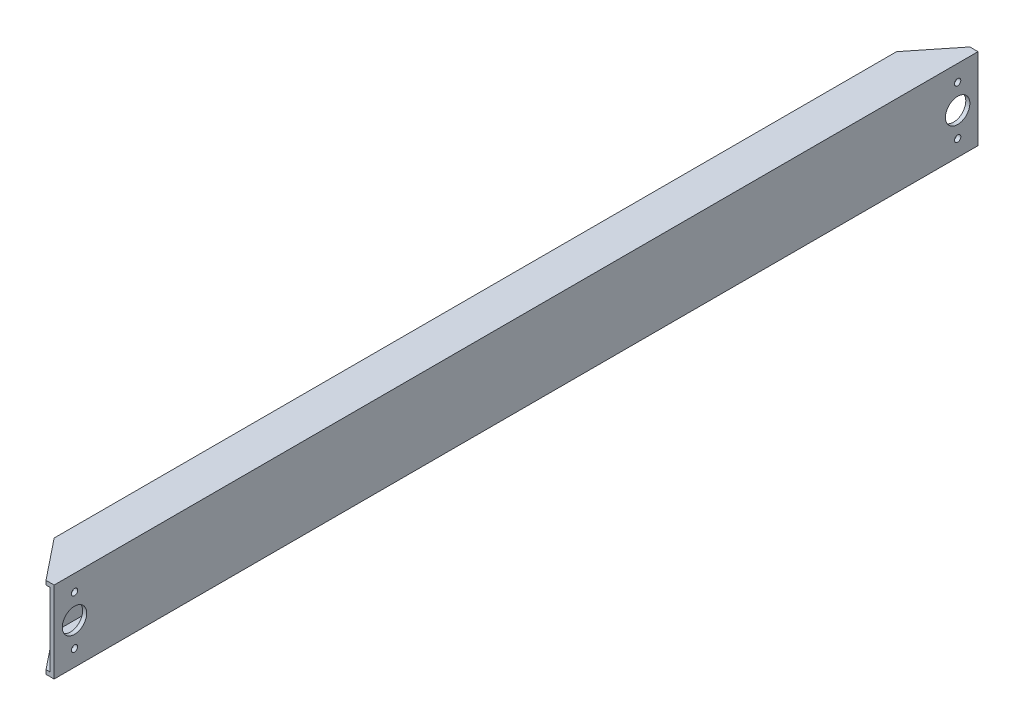
from build123d import *

# Parameters (mm, degrees)
SKETCH1_W                    = 31.75
SKETCH1_H                    = 63.5
SKETCH1_W_2                  = 25.4
SKETCH1_H_2                  = 57.15
BOSS_EXTRUDE1_DEPTH          = 720.4964
CUT_EXTRUDE1_REACH           = 725.554
F_10_0_1935_DIAMETER_HOLE1_D = 4.9149
SKETCH3_R                    = 9.525
CUT_EXTRUDE2_DEPTH           = 3.175


with BuildPart() as part:
    # Sketch1 → Boss-Extrude1 (new body)
    with BuildSketch(Plane.XY):
        with Locations((3.710272719, -29.23968021)):
            Rectangle(SKETCH1_W, SKETCH1_H)
        with Locations((3.710272719, -29.23968021)):
            Rectangle(SKETCH1_W_2, SKETCH1_H_2, mode=Mode.SUBTRACT)
    extrude(amount=BOSS_EXTRUDE1_DEPTH)

    # Cut-Extrude1: up to this face of the body (flat: up to its plane)
    cut_extrude1_end = Plane(part.part.faces().sort_by_distance((3.710272719, -60.98968021, 360.2482))[0])
    # Sketch2 → Cut-Extrude1 (cut, up to the picked face)
    with BuildSketch(Plane(origin=(0, 2.51031979, 0), x_dir=(1, 0, 0), z_dir=(0, 1, 0)), mode=Mode.PRIVATE) as cut_extrude1_sk1:
        Polygon((-12.164727281, -31.75), (13.235272719, 0), (-12.164727281, 0), align=None)
    cut_extrude1_tool1 = split(extrude(cut_extrude1_sk1.sketch, amount=-CUT_EXTRUDE1_REACH, mode=Mode.PRIVATE), bisect_by=cut_extrude1_end, keep=Keep.BOTH, mode=Mode.PRIVATE)
    # Sketch2 → Cut-Extrude1 (cut, up to the picked face)
    with BuildSketch(Plane(origin=(0, 2.51031979, 0), x_dir=(1, 0, 0), z_dir=(0, 1, 0)), mode=Mode.PRIVATE) as cut_extrude1_sk2:
        Polygon((13.235272719, -720.4964), (-12.164727281, -688.7464), (-12.164727281, -720.4964), align=None)
    cut_extrude1_tool2 = split(extrude(cut_extrude1_sk2.sketch, amount=-CUT_EXTRUDE1_REACH, mode=Mode.PRIVATE), bisect_by=cut_extrude1_end, keep=Keep.BOTH, mode=Mode.PRIVATE)
    add(cut_extrude1_tool1.solids().sort_by(Axis((-3.698061, 2.51032, 10.583333), (0, -1, 0)))[0], mode=Mode.SUBTRACT)
    add(cut_extrude1_tool2.solids().sort_by(Axis((-3.698061, 2.51032, 709.913067), (0, -1, 0)))[0], mode=Mode.SUBTRACT)

    # #10 (0.1935) Diameter Hole1 (through all)
    with Locations(Plane(origin=(16.410272719, -10.18968021, 15.875), x_dir=(0, -1, 0), z_dir=(-1, 0, 0))):
        with Locations((0, 0), (38.1, 0), (0, 688.7464), (38.1, 688.7464)):
            Hole(F_10_0_1935_DIAMETER_HOLE1_D / 2)

    # Sketch3 → Cut-Extrude2 (cut)
    with BuildSketch(Plane.ZY.offset(-16.410272719)):
        with Locations(Location((15.875, -29.23968021, 0), (0, 0, 270))):
            Circle(SKETCH3_R)
        with Locations(Location((704.6214, -29.23968021, 0), (0, 0, 270))):
            Circle(SKETCH3_R)
    extrude(amount=-CUT_EXTRUDE2_DEPTH, mode=Mode.SUBTRACT)


solid = part.part
